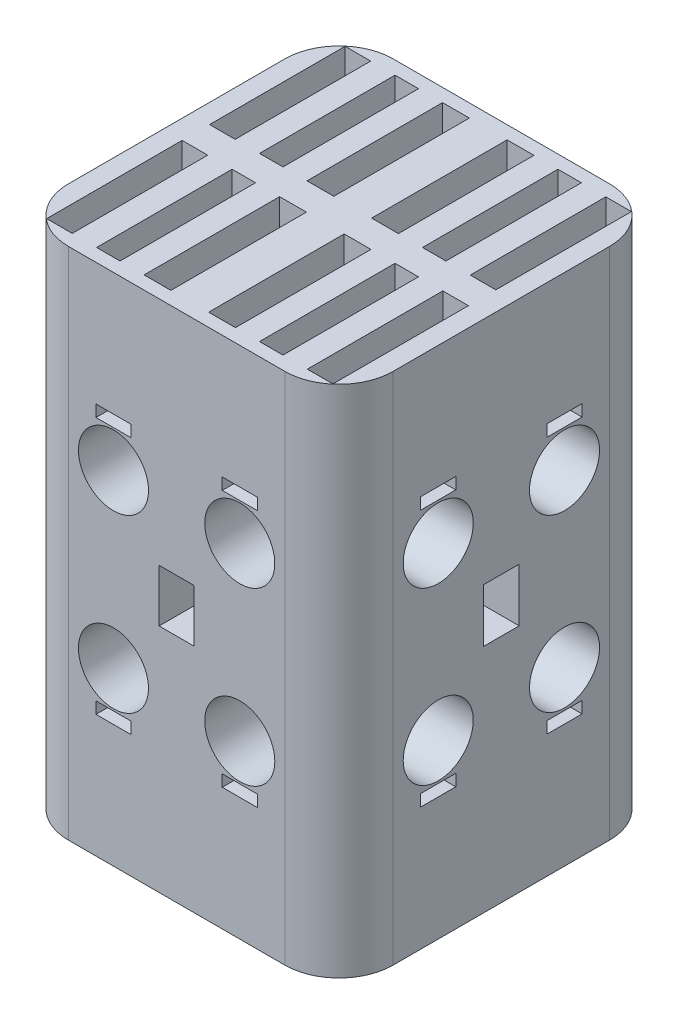
from build123d import *

# Parameters (mm, degrees)
BOSS_EXTRUDE1_DEPTH  = 95
SKETCH3_R            = 6.47269
SKETCH3_W            = 6.47269
SKETCH3_H            = 2.157563333
SKETCH3_W_2          = 6.582334788
SKETCH3_H_2          = 9.873502183
CUT_EXTRUDE1_DEPTH   = 10
SKETCH5_R            = 6.47269
SKETCH5_W            = 6.47269
SKETCH5_H            = 2.157563334
SKETCH5_H_2          = 9.709035
CUT_EXTRUDE2_DEPTH   = 10
SKETCH6_R            = 6.47269
SKETCH6_W            = 6.47269
SKETCH6_H            = 2.157563333
SKETCH6_W_2          = 7.537810804
SKETCH6_H_2          = 11.306716207
CUT_EXTRUDE3_DEPTH   = 10
SKETCH2_R            = 6.47269
SKETCH2_W            = 6.47269
SKETCH2_H            = 2.157563334
SKETCH2_H_2          = 9.709035
CUT_EXTRUDE4_DEPTH   = 10
SKETCH7_W            = 4.726267471
SKETCH7_H            = 25.037941994
SKETCH7_W_2          = 4.332434436
SKETCH7_W_3          = 4.951327827
CUT_EXTRUDE5_DEPTH   = 5
SKETCH11_W           = 1.62976
SKETCH11_H           = 0.81488
BOSS_EXTRUDE3_DEPTH  = 2
SKETCH12_W           = 1.62976
SKETCH12_H           = 0.81488
BOSS_EXTRUDE4_DEPTH  = 2
SKETCH13_W           = 1.62976
SKETCH13_H           = 0.81488
BOSS_EXTRUDE5_DEPTH  = 2
SKETCH14_W           = 1.62976
SKETCH14_H           = 0.81488
BOSS_EXTRUDE6_DEPTH  = 2
SKETCH15_R           = 0.202066
SKETCH15_W           = 4.45706
SKETCH15_H           = 2.22853
BOSS_EXTRUDE7_DEPTH  = 2
SKETCH16_R           = 0.202066
SKETCH16_W           = 4.45706
SKETCH16_H           = 2.22853
BOSS_EXTRUDE8_DEPTH  = 2
SKETCH18_R           = 0.202066
SKETCH18_W           = 4.45706
SKETCH18_H           = 2.22853
BOSS_EXTRUDE9_DEPTH  = 2
SKETCH19_R           = 0.202066
SKETCH19_W           = 4.45706
SKETCH19_H           = 2.22853
BOSS_EXTRUDE10_DEPTH = 2
SKETCH20_W           = 35.67655705
SKETCH20_H           = 35.67655705
CUT_EXTRUDE6_DEPTH   = 84


with BuildPart() as part:
    # Sketch1 → Boss-Extrude1 (new body)
    with BuildSketch(Plane(origin=(0, 0, 0), x_dir=(1, 0, 0), z_dir=(0, 1, 0))):
        with BuildLine():
            Line((-20, 30), (20, 30))
            ThreePointArc((20, 30), (27.071067812, 27.071067812), (30, 20))
            Line((30, 20), (30, -20))
            ThreePointArc((30, -20), (27.071067812, -27.071067812), (20, -30))
            Line((20, -30), (-20, -30))
            ThreePointArc((-20, -30), (-27.071067812, -27.071067812), (-30, -20))
            Line((-30, -20), (-30, 20))
            ThreePointArc((-30, 20), (-27.071067812, 27.071067812), (-20, 30))
        make_face()
    extrude(amount=BOSS_EXTRUDE1_DEPTH)

    # Sketch3 → Cut-Extrude1 (cut)
    with BuildSketch(Plane(origin=(30, 0, 0), x_dir=(0, 0, -1), z_dir=(1, 0, 0))):
        with Locations((-11.66666671, 63.35458368)):
            Circle(SKETCH3_R)
        with Locations(Location((11.66666671, 63.35458368, 0), (0, 0, 180))):
            Circle(SKETCH3_R)
        with Locations((11.66666671, 31.798135847)):
            Circle(SKETCH3_R)
        with Locations(Location((-11.66666671, 31.798135847, 0), (0, 0, 180))):
            Circle(SKETCH3_R)
        with Locations((-11.666666667, 71.326359763)):
            Rectangle(SKETCH3_W, SKETCH3_H)
        with Locations((11.666666667, 71.326359763)):
            Rectangle(SKETCH3_W, SKETCH3_H)
        with Locations((11.666666667, 23.826359764)):
            Rectangle(SKETCH3_W, SKETCH3_H)
        with Locations((-11.666666667, 23.826359764)):
            Rectangle(SKETCH3_W, SKETCH3_H)
        with Locations((0, 47.576359764)):
            Rectangle(SKETCH3_W_2, SKETCH3_H_2)
    extrude(amount=-CUT_EXTRUDE1_DEPTH, mode=Mode.SUBTRACT)

    # Sketch5 → Cut-Extrude2 (cut)
    with BuildSketch(Plane.XY.offset(30)):
        with Locations((-11.666666667, 63.333333333)):
            Circle(SKETCH5_R)
        with Locations(Location((11.666666667, 63.333333333, 0), (0, 0, 180))):
            Circle(SKETCH5_R)
        with Locations((11.666666667, 31.666666667)):
            Circle(SKETCH5_R)
        with Locations(Location((-11.666666667, 31.666666667, 0), (0, 0, 180))):
            Circle(SKETCH5_R)
        with Locations((-11.666666667, 71.25)):
            Rectangle(SKETCH5_W, SKETCH5_H)
        with Locations((11.666666667, 71.25)):
            Rectangle(SKETCH5_W, SKETCH5_H)
        with Locations((11.666666667, 23.75)):
            Rectangle(SKETCH5_W, SKETCH5_H)
        with Locations((-11.666666667, 23.75)):
            Rectangle(SKETCH5_W, SKETCH5_H)
        with Locations((0, 47.5)):
            Rectangle(SKETCH5_W, SKETCH5_H_2)
    extrude(amount=-CUT_EXTRUDE2_DEPTH, mode=Mode.SUBTRACT)

    # Sketch6 → Cut-Extrude3 (cut)
    with BuildSketch(Plane.ZY.offset(30)):
        with Locations((-11.666666667, 63.25697357)):
            Circle(SKETCH6_R)
        with Locations(Location((11.666666667, 63.25697357, 0), (0, 0, 180))):
            Circle(SKETCH6_R)
        with Locations((11.666666667, 31.590306903)):
            Circle(SKETCH6_R)
        with Locations(Location((-11.666666667, 31.590306903, 0), (0, 0, 180))):
            Circle(SKETCH6_R)
        with Locations((-11.666666667, 71.173640237)):
            Rectangle(SKETCH6_W, SKETCH6_H)
        with Locations((11.666666667, 71.173640237)):
            Rectangle(SKETCH6_W, SKETCH6_H)
        with Locations((11.666666667, 23.673640237)):
            Rectangle(SKETCH6_W, SKETCH6_H)
        with Locations((-11.666666667, 23.673640237)):
            Rectangle(SKETCH6_W, SKETCH6_H)
        with Locations((0, 47.423640237)):
            Rectangle(SKETCH6_W_2, SKETCH6_H_2)
    extrude(amount=-CUT_EXTRUDE3_DEPTH, mode=Mode.SUBTRACT)

    # Sketch2 → Cut-Extrude4 (cut)
    with BuildSketch(Plane(origin=(0, 0, -30), x_dir=(-1, 0, 0), z_dir=(0, 0, -1))):
        with Locations((-10, 63.333333333)):
            Circle(SKETCH2_R)
        with Locations(Location((10, 63.333333333, 0), (0, 0, 180))):
            Circle(SKETCH2_R)
        with Locations((10, 31.666666667)):
            Circle(SKETCH2_R)
        with Locations(Location((-10, 31.666666667, 0), (0, 0, 180))):
            Circle(SKETCH2_R)
        with Locations((-10, 71.25)):
            Rectangle(SKETCH2_W, SKETCH2_H)
        with Locations((10, 71.25)):
            Rectangle(SKETCH2_W, SKETCH2_H)
        with Locations((10, 23.75)):
            Rectangle(SKETCH2_W, SKETCH2_H)
        with Locations((-10, 23.75)):
            Rectangle(SKETCH2_W, SKETCH2_H)
        with Locations((0, 47.5)):
            Rectangle(SKETCH2_W, SKETCH2_H_2)
    extrude(amount=-CUT_EXTRUDE4_DEPTH, mode=Mode.SUBTRACT)

    # Sketch7 → Cut-Extrude5 (cut)
    with BuildSketch(Plane(origin=(0, 95, 0), x_dir=(1, 0, 0), z_dir=(0, 1, 0))):
        with Locations((-24.08145807, 15.0509)):
            Rectangle(SKETCH7_W, SKETCH7_H)
        with Locations((-15.0509, 15.0509)):
            Rectangle(SKETCH7_W_2, SKETCH7_H)
        with Locations((-5.964099429, 15.0509)):
            Rectangle(SKETCH7_W_3, SKETCH7_H)
        with Locations((5.964099429, 15.0509)):
            Rectangle(SKETCH7_W_3, SKETCH7_H)
        with Locations((15.0509, 15.0509)):
            Rectangle(SKETCH7_W_2, SKETCH7_H)
        with Locations((24.08145807, 15.0509)):
            Rectangle(SKETCH7_W, SKETCH7_H)
        with Locations((24.08145807, -15.0509)):
            Rectangle(SKETCH7_W, SKETCH7_H)
        with Locations((15.0509, -15.0509)):
            Rectangle(SKETCH7_W_2, SKETCH7_H)
        with Locations((5.964099429, -15.0509)):
            Rectangle(SKETCH7_W_3, SKETCH7_H)
        with Locations((-5.964099429, -15.0509)):
            Rectangle(SKETCH7_W_3, SKETCH7_H)
        with Locations((-15.0509, -15.0509)):
            Rectangle(SKETCH7_W_2, SKETCH7_H)
        with Locations((-24.08145807, -15.0509)):
            Rectangle(SKETCH7_W, SKETCH7_H)
    extrude(amount=-CUT_EXTRUDE5_DEPTH, mode=Mode.SUBTRACT)

    # Sketch11 → Boss-Extrude3 (add)
    with BuildSketch(Plane.XY.offset(20)):
        with Locations((-11.666666667, 63.333333333)):
            Rectangle(SKETCH11_W, SKETCH11_H)
        with Locations((11.666666667, 63.333333333)):
            Rectangle(SKETCH11_W, SKETCH11_H)
        with Locations((11.666666667, 31.666666667)):
            Rectangle(SKETCH11_W, SKETCH11_H)
        with Locations((-11.666666667, 31.666666667)):
            Rectangle(SKETCH11_W, SKETCH11_H)
    extrude(amount=BOSS_EXTRUDE3_DEPTH)

    # Sketch12 → Boss-Extrude4 (add)
    with BuildSketch(Plane(origin=(20, 0, 0), x_dir=(0, 0, -1), z_dir=(1, 0, 0))):
        with Locations((11.66666671, 63.35458368)):
            Rectangle(SKETCH12_W, SKETCH12_H)
        with Locations((-11.66666671, 63.35458368)):
            Rectangle(SKETCH12_W, SKETCH12_H)
        with Locations((11.66666671, 31.64541632)):
            Rectangle(SKETCH12_W, SKETCH12_H)
        with Locations((-11.66666671, 31.64541632)):
            Rectangle(SKETCH12_W, SKETCH12_H)
    extrude(amount=BOSS_EXTRUDE4_DEPTH)

    # Sketch13 → Boss-Extrude5 (add)
    with BuildSketch(Plane(origin=(0, 0, -20), x_dir=(-1, 0, 0), z_dir=(0, 0, -1))):
        with Locations((10, 63.333333333)):
            Rectangle(SKETCH13_W, SKETCH13_H)
        with Locations((-10, 63.333333333)):
            Rectangle(SKETCH13_W, SKETCH13_H)
        with Locations((10, 31.666666667)):
            Rectangle(SKETCH13_W, SKETCH13_H)
        with Locations((-10, 31.666666667)):
            Rectangle(SKETCH13_W, SKETCH13_H)
    extrude(amount=BOSS_EXTRUDE5_DEPTH)

    # Sketch14 → Boss-Extrude6 (add)
    with BuildSketch(Plane.ZY.offset(20)):
        with Locations((11.666666667, 63.25697357)):
            Rectangle(SKETCH14_W, SKETCH14_H)
        with Locations((-11.666666667, 63.25697357)):
            Rectangle(SKETCH14_W, SKETCH14_H)
        with Locations((11.666666667, 31.74302643)):
            Rectangle(SKETCH14_W, SKETCH14_H)
        with Locations((-11.666666667, 31.74302643)):
            Rectangle(SKETCH14_W, SKETCH14_H)
    extrude(amount=BOSS_EXTRUDE6_DEPTH)

    # Sketch15 → Boss-Extrude7 (add)
    with BuildSketch(Plane.ZY.offset(20)):
        with Locations((-1.914578009, 52.122885457)):
            Circle(SKETCH15_R)
        with Locations((-0.645657956, 52.130428212)):
            Circle(SKETCH15_R)
        with Locations((0.623262097, 52.137970966)):
            Circle(SKETCH15_R)
        with Locations((1.89218215, 52.145513721)):
            Circle(SKETCH15_R)
        with Locations((1.865e-06, 49.72853)):
            Rectangle(SKETCH15_W, SKETCH15_H)
    extrude(amount=BOSS_EXTRUDE7_DEPTH)

    # Sketch16 → Boss-Extrude8 (add)
    with BuildSketch(Plane.XY.offset(20)):
        with Locations((-1.917115075, 51.507844989)):
            Circle(SKETCH16_R)
        with Locations((-0.658335111, 51.503180473)):
            Circle(SKETCH16_R)
        with Locations((0.600444853, 51.498515958)):
            Circle(SKETCH16_R)
        with Locations((1.859224817, 51.493851442)):
            Circle(SKETCH16_R)
        with Locations((0, 49.72853)):
            Rectangle(SKETCH16_W, SKETCH16_H)
    extrude(amount=BOSS_EXTRUDE8_DEPTH)

    # Sketch18 → Boss-Extrude9 (add)
    with BuildSketch(Plane(origin=(20, 0, 0), x_dir=(0, 0, -1), z_dir=(1, 0, 0))):
        with Locations((-1.873745125, 51.681666909)):
            Circle(SKETCH18_R)
        with Locations((-0.627258597, 51.681847658)):
            Circle(SKETCH18_R)
        with Locations((0.619227932, 51.682028407)):
            Circle(SKETCH18_R)
        with Locations((1.865714461, 51.682209156)):
            Circle(SKETCH18_R)
        with Locations((0, 49.72853)):
            Rectangle(SKETCH18_W, SKETCH18_H)
    extrude(amount=BOSS_EXTRUDE9_DEPTH)

    # Sketch19 → Boss-Extrude10 (add)
    with BuildSketch(Plane(origin=(0, 0, -20), x_dir=(-1, 0, 0), z_dir=(0, 0, -1))):
        with Locations((-1.882709699, 51.459158687)):
            Circle(SKETCH19_R)
        with Locations((-0.617790382, 51.465560249)):
            Circle(SKETCH19_R)
        with Locations((0.647128935, 51.471961811)):
            Circle(SKETCH19_R)
        with Locations((1.912048251, 51.478363373)):
            Circle(SKETCH19_R)
        with Locations((0, 49.72853)):
            Rectangle(SKETCH19_W, SKETCH19_H)
    extrude(amount=BOSS_EXTRUDE10_DEPTH)

    # Sketch20 → Cut-Extrude6 (cut)
    with BuildSketch(Plane.XZ):
        Rectangle(SKETCH20_W, SKETCH20_H)
    extrude(amount=-CUT_EXTRUDE6_DEPTH, mode=Mode.SUBTRACT)


solid = part.part
